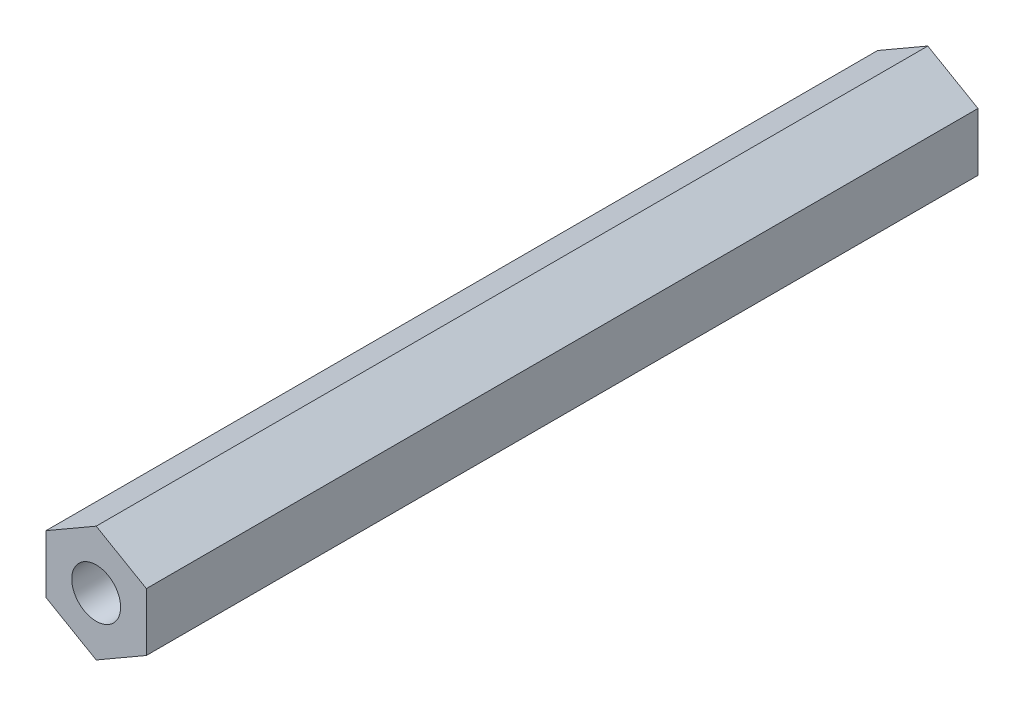
from build123d import *

# Parameters (mm, degrees)
BOSS_EXTRUDE1_DEPTH = 46.0375
SKETCH3_R           = 2.7051
CUT_EXTRUDE1_DEPTH  = 38.1
CUT_EXTRUDE2_START  = -38.1
SKETCH4_R           = 2.7051
CUT_EXTRUDE2_DEPTH  = 38.1


with BuildPart() as part:
    # Sketch2 → Boss-Extrude1 (new, symmetric)
    with BuildSketch(Plane.XY):
        Polygon((0, 6.415804866), (-5.55625, 3.207902433), (-5.55625, -3.207902433), (0, -6.415804866), (5.55625, -3.207902433), (5.55625, 3.207902433), align=None)
    extrude(amount=BOSS_EXTRUDE1_DEPTH, both=True)

    # Sketch3 → Cut-Extrude1 (cut)
    with BuildSketch(Plane.XY.offset(46.0375)):
        Circle(SKETCH3_R)
    extrude(amount=-CUT_EXTRUDE1_DEPTH, mode=Mode.SUBTRACT)

    # Sketch4 → Cut-Extrude2 (cut)
    with BuildSketch(Plane(origin=(0, 0, -46.0375), x_dir=(-1, 0, 0), z_dir=(0, 0, -1)).offset(CUT_EXTRUDE2_START)):
        with Locations(Location((0, 0, 0), (0, 0, 180))):
            Circle(SKETCH4_R)
    extrude(amount=CUT_EXTRUDE2_DEPTH, mode=Mode.SUBTRACT)


solid = part.part
